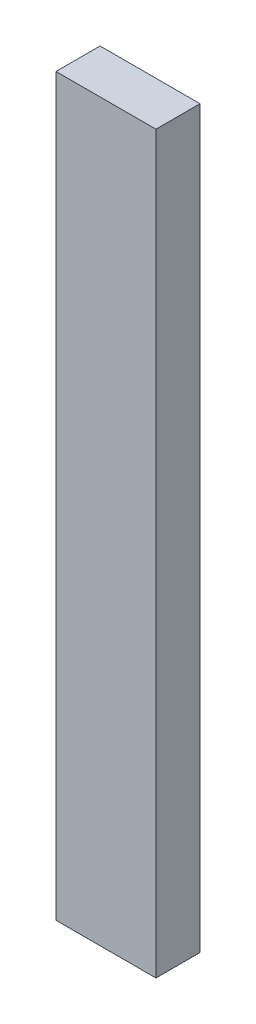
from build123d import *

# Parameters (mm, degrees)
SKETCH1_W           = 3.4
SKETCH1_H           = 25
BOSS_EXTRUDE1_DEPTH = 1.5


with BuildPart() as part:
    # Sketch1 → Boss-Extrude1 (new body)
    with BuildSketch(Plane.XY):
        Rectangle(SKETCH1_W, SKETCH1_H)
    extrude(amount=BOSS_EXTRUDE1_DEPTH)


solid = part.part
